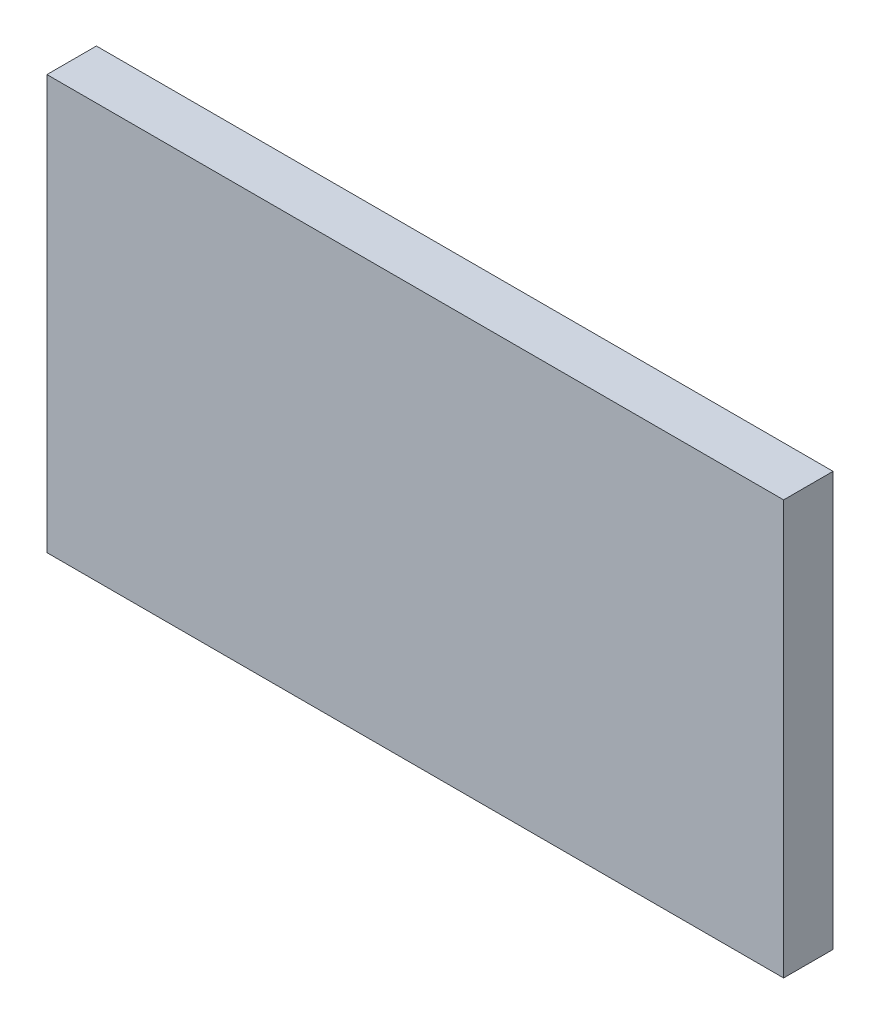
from build123d import *

# Parameters (mm, degrees)
SKETCH1_W           = 596
SKETCH1_H           = 335
BOSS_EXTRUDE1_DEPTH = 40


with BuildPart() as part:
    # Sketch1 → Boss-Extrude1 (new body)
    with BuildSketch(Plane.XY):
        Rectangle(SKETCH1_W, SKETCH1_H)
    extrude(amount=BOSS_EXTRUDE1_DEPTH)


solid = part.part
